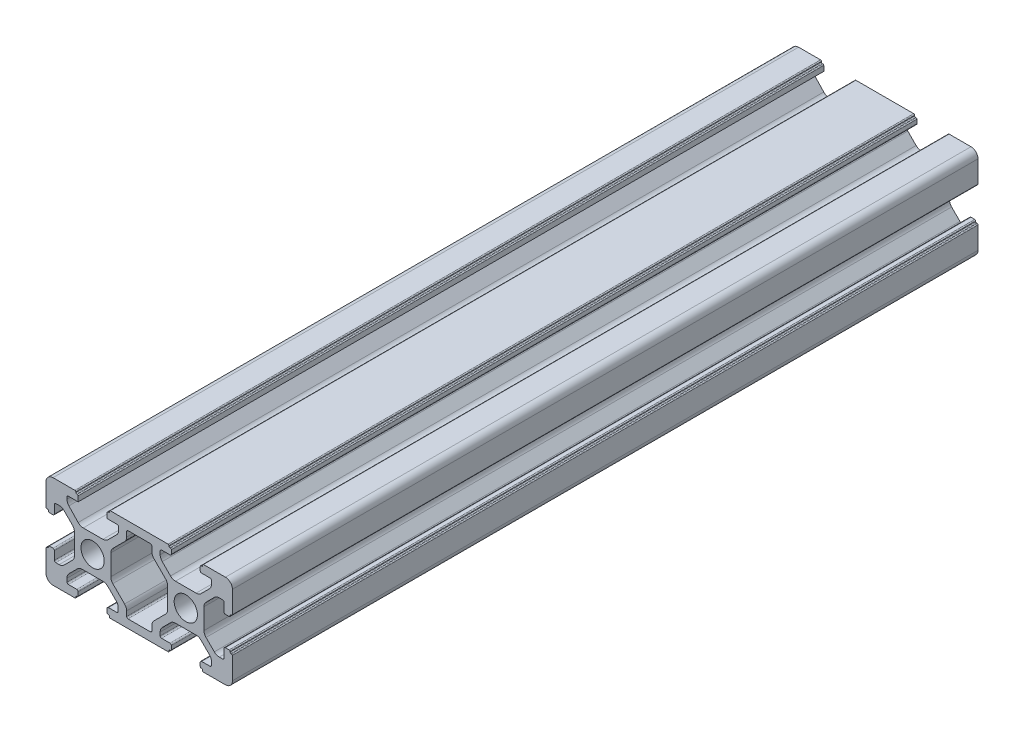
from build123d import *

# Parameters (mm, degrees)
SKETCH1_R           = 2.5
BOSS_EXTRUDE2_DEPTH = 160


with BuildPart() as part:
    # Sketch1 → Boss-Extrude2 (new body)
    with BuildSketch(Plane.XY):
        with BuildLine():
            Line((1.5, 0), (6.2, 0))
            ThreePointArc((6.2, 0), (6.341421356, 0.058578644), (6.4, 0.2))
            Line((6.4, 0.2), (6.4, 0.3))
            ThreePointArc((6.4, 0.3), (6.458578644, 0.441421356), (6.6, 0.5))
            Line((6.6, 0.5), (6.7, 0.5))
            ThreePointArc((6.7, 0.5), (6.841421356, 0.558578644), (6.9, 0.7))
            Line((6.9, 0.7), (6.9, 1.5))
            ThreePointArc((6.9, 1.5), (6.812132034, 1.712132034), (6.6, 1.8))
            Line((6.6, 1.8), (4.8, 1.8))
            ThreePointArc((4.8, 1.8), (4.587867966, 1.887867966), (4.5, 2.1))
            Line((4.5, 2.1), (4.5, 2.818019485))
            ThreePointArc((4.5, 2.818019485), (4.614180701, 3.392044633), (4.939339828, 3.878679656))
            Line((4.939339828, 3.878679656), (6.721320344, 5.660660172))
            ThreePointArc((6.721320344, 5.660660172), (7.207955367, 5.985819299), (7.781980515, 6.1))
            Line((7.781980515, 6.1), (12.218019485, 6.1))
            ThreePointArc((12.218019485, 6.1), (12.792044633, 5.985819299), (13.278679656, 5.660660172))
            Line((13.278679656, 5.660660172), (15.060660172, 3.878679656))
            ThreePointArc((15.060660172, 3.878679656), (15.385819299, 3.392044633), (15.5, 2.818019485))
            Line((15.5, 2.818019485), (15.5, 2.1))
            ThreePointArc((15.5, 2.1), (15.412132034, 1.887867966), (15.2, 1.8))
            Line((15.2, 1.8), (13.4, 1.8))
            ThreePointArc((13.4, 1.8), (13.187867966, 1.712132034), (13.1, 1.5))
            Line((13.1, 1.5), (13.1, 0.7))
            ThreePointArc((13.1, 0.7), (13.158578644, 0.558578644), (13.3, 0.5))
            Line((13.3, 0.5), (13.4, 0.5))
            ThreePointArc((13.4, 0.5), (13.541421356, 0.441421356), (13.6, 0.3))
            Line((13.6, 0.3), (13.6, 0.2))
            ThreePointArc((13.6, 0.2), (13.658578644, 0.058578644), (13.8, 0))
            Line((13.8, 0), (26.2, 0))
            ThreePointArc((26.2, 0), (26.341421356, 0.058578644), (26.4, 0.2))
            Line((26.4, 0.2), (26.4, 0.3))
            ThreePointArc((26.4, 0.3), (26.458578644, 0.441421356), (26.6, 0.5))
            Line((26.6, 0.5), (26.7, 0.5))
            ThreePointArc((26.7, 0.5), (26.841421356, 0.558578644), (26.9, 0.7))
            Line((26.9, 0.7), (26.9, 1.5))
            ThreePointArc((26.9, 1.5), (26.812132034, 1.712132034), (26.6, 1.8))
            Line((26.6, 1.8), (24.8, 1.8))
            ThreePointArc((24.8, 1.8), (24.587867966, 1.887867966), (24.5, 2.1))
            Line((24.5, 2.1), (24.5, 2.818019485))
            ThreePointArc((24.5, 2.818019485), (24.614180701, 3.392044633), (24.939339828, 3.878679656))
            Line((24.939339828, 3.878679656), (26.721320344, 5.660660172))
            ThreePointArc((26.721320344, 5.660660172), (27.207955367, 5.985819299), (27.781980515, 6.1))
            Line((27.781980515, 6.1), (32.218019485, 6.1))
            ThreePointArc((32.218019485, 6.1), (32.792044633, 5.985819299), (33.278679656, 5.660660172))
            Line((33.278679656, 5.660660172), (35.060660172, 3.878679656))
            ThreePointArc((35.060660172, 3.878679656), (35.385819299, 3.392044633), (35.5, 2.818019485))
            Line((35.5, 2.818019485), (35.5, 2.1))
            ThreePointArc((35.5, 2.1), (35.412132034, 1.887867966), (35.2, 1.8))
            Line((35.2, 1.8), (33.4, 1.8))
            ThreePointArc((33.4, 1.8), (33.187867966, 1.712132034), (33.1, 1.5))
            Line((33.1, 1.5), (33.1, 0.7))
            ThreePointArc((33.1, 0.7), (33.158578644, 0.558578644), (33.3, 0.5))
            Line((33.3, 0.5), (33.4, 0.5))
            ThreePointArc((33.4, 0.5), (33.541421356, 0.441421356), (33.6, 0.3))
            Line((33.6, 0.3), (33.6, 0.2))
            ThreePointArc((33.6, 0.2), (33.658578644, 0.058578644), (33.8, 0))
            Line((33.8, 0), (38.5, 0))
            ThreePointArc((38.5, 0), (39.560660172, 0.439339828), (40, 1.5))
            Line((40, 1.5), (40, 6.2))
            ThreePointArc((40, 6.2), (39.941421356, 6.341421356), (39.8, 6.4))
            Line((39.8, 6.4), (39.7, 6.4))
            ThreePointArc((39.7, 6.4), (39.558578644, 6.458578644), (39.5, 6.6))
            Line((39.5, 6.6), (39.5, 6.7))
            ThreePointArc((39.5, 6.7), (39.441421356, 6.841421356), (39.3, 6.9))
            Line((39.3, 6.9), (38.5, 6.9))
            ThreePointArc((38.5, 6.9), (38.287867966, 6.812132034), (38.2, 6.6))
            Line((38.2, 6.6), (38.2, 4.8))
            ThreePointArc((38.2, 4.8), (38.112132034, 4.587867966), (37.9, 4.5))
            Line((37.9, 4.5), (37.181980515, 4.5))
            ThreePointArc((37.181980515, 4.5), (36.607955367, 4.614180701), (36.121320344, 4.939339828))
            Line((36.121320344, 4.939339828), (34.339339828, 6.721320344))
            ThreePointArc((34.339339828, 6.721320344), (34.014180701, 7.207955367), (33.9, 7.781980515))
            Line((33.9, 7.781980515), (33.9, 12.218019485))
            ThreePointArc((33.9, 12.218019485), (34.014180701, 12.792044633), (34.339339828, 13.278679656))
            Line((34.339339828, 13.278679656), (36.121320344, 15.060660172))
            ThreePointArc((36.121320344, 15.060660172), (36.607955367, 15.385819299), (37.181980515, 15.5))
            Line((37.181980515, 15.5), (37.9, 15.5))
            ThreePointArc((37.9, 15.5), (38.112132034, 15.412132034), (38.2, 15.2))
            Line((38.2, 15.2), (38.2, 13.4))
            ThreePointArc((38.2, 13.4), (38.287867966, 13.187867966), (38.5, 13.1))
            Line((38.5, 13.1), (39.3, 13.1))
            ThreePointArc((39.3, 13.1), (39.441421356, 13.158578644), (39.5, 13.3))
            Line((39.5, 13.3), (39.5, 13.4))
            ThreePointArc((39.5, 13.4), (39.558578644, 13.541421356), (39.7, 13.6))
            Line((39.7, 13.6), (39.8, 13.6))
            ThreePointArc((39.8, 13.6), (39.941421356, 13.658578644), (40, 13.8))
            Line((40, 13.8), (40, 18.5))
            ThreePointArc((40, 18.5), (39.560660172, 19.560660172), (38.5, 20))
            Line((38.5, 20), (33.8, 20))
            ThreePointArc((33.8, 20), (33.658578644, 19.941421356), (33.6, 19.8))
            Line((33.6, 19.8), (33.6, 19.7))
            ThreePointArc((33.6, 19.7), (33.541421356, 19.558578644), (33.4, 19.5))
            Line((33.4, 19.5), (33.3, 19.5))
            ThreePointArc((33.3, 19.5), (33.158578644, 19.441421356), (33.1, 19.3))
            Line((33.1, 19.3), (33.1, 18.5))
            ThreePointArc((33.1, 18.5), (33.187867966, 18.287867966), (33.4, 18.2))
            Line((33.4, 18.2), (35.2, 18.2))
            ThreePointArc((35.2, 18.2), (35.412132034, 18.112132034), (35.5, 17.9))
            Line((35.5, 17.9), (35.5, 17.181980515))
            ThreePointArc((35.5, 17.181980515), (35.385819299, 16.607955367), (35.060660172, 16.121320344))
            Line((35.060660172, 16.121320344), (33.278679656, 14.339339828))
            ThreePointArc((33.278679656, 14.339339828), (32.792044633, 14.014180701), (32.218019485, 13.9))
            Line((32.218019485, 13.9), (27.781980515, 13.9))
            ThreePointArc((27.781980515, 13.9), (27.207955367, 14.014180701), (26.721320344, 14.339339828))
            Line((26.721320344, 14.339339828), (24.939339828, 16.121320344))
            ThreePointArc((24.939339828, 16.121320344), (24.614180701, 16.607955367), (24.5, 17.181980515))
            Line((24.5, 17.181980515), (24.5, 17.9))
            ThreePointArc((24.5, 17.9), (24.587867966, 18.112132034), (24.8, 18.2))
            Line((24.8, 18.2), (26.6, 18.2))
            ThreePointArc((26.6, 18.2), (26.812132034, 18.287867966), (26.9, 18.5))
            Line((26.9, 18.5), (26.9, 19.3))
            ThreePointArc((26.9, 19.3), (26.841421356, 19.441421356), (26.7, 19.5))
            Line((26.7, 19.5), (26.6, 19.5))
            ThreePointArc((26.6, 19.5), (26.458578644, 19.558578644), (26.4, 19.7))
            Line((26.4, 19.7), (26.4, 19.8))
            ThreePointArc((26.4, 19.8), (26.341421356, 19.941421356), (26.2, 20))
            Line((26.2, 20), (13.8, 20))
            ThreePointArc((13.8, 20), (13.658578644, 19.941421356), (13.6, 19.8))
            Line((13.6, 19.8), (13.6, 19.7))
            ThreePointArc((13.6, 19.7), (13.541421356, 19.558578644), (13.4, 19.5))
            Line((13.4, 19.5), (13.3, 19.5))
            ThreePointArc((13.3, 19.5), (13.158578644, 19.441421356), (13.1, 19.3))
            Line((13.1, 19.3), (13.1, 18.2))
            Line((13.1, 18.2), (15.3, 18.2))
            ThreePointArc((15.3, 18.2), (15.512132034, 18.112132034), (15.6, 17.9))
            Line((15.6, 17.9), (15.6, 17.281980515))
            ThreePointArc((15.6, 17.281980515), (15.485819299, 16.707955367), (15.160660172, 16.221320344))
            Line((15.160660172, 16.221320344), (13.278679656, 14.339339828))
            ThreePointArc((13.278679656, 14.339339828), (12.792044633, 14.014180701), (12.218019485, 13.9))
            Line((12.218019485, 13.9), (7.986375635, 13.9))
            ThreePointArc((7.986375635, 13.9), (7.393381044, 14.022191082), (6.896997987, 14.36885678))
            Line((6.896997987, 14.36885678), (4.910622352, 16.467414163))
            ThreePointArc((4.910622352, 16.467414163), (4.606431474, 16.943609851), (4.5, 17.498557383))
            Line((4.5, 17.498557383), (4.5, 17.9))
            ThreePointArc((4.5, 17.9), (4.587867966, 18.112132034), (4.8, 18.2))
            Line((4.8, 18.2), (6.9, 18.2))
            Line((6.9, 18.2), (6.9, 19.3))
            ThreePointArc((6.9, 19.3), (6.841421356, 19.441421356), (6.7, 19.5))
            Line((6.7, 19.5), (6.6, 19.5))
            ThreePointArc((6.6, 19.5), (6.458578644, 19.558578644), (6.4, 19.7))
            Line((6.4, 19.7), (6.4, 19.8))
            ThreePointArc((6.4, 19.8), (6.341421356, 19.941421356), (6.2, 20))
            Line((6.2, 20), (1.5, 20))
            ThreePointArc((1.5, 20), (0.439339828, 19.560660172), (0, 18.5))
            Line((0, 18.5), (0, 13.8))
            ThreePointArc((0, 13.8), (0.058578644, 13.658578644), (0.2, 13.6))
            Line((0.2, 13.6), (0.3, 13.6))
            ThreePointArc((0.3, 13.6), (0.441421356, 13.541421356), (0.5, 13.4))
            Line((0.5, 13.4), (0.5, 13.3))
            ThreePointArc((0.5, 13.3), (0.558578644, 13.158578644), (0.7, 13.1))
            Line((0.7, 13.1), (1.5, 13.1))
            ThreePointArc((1.5, 13.1), (1.712132034, 13.187867966), (1.8, 13.4))
            Line((1.8, 13.4), (1.8, 15.2))
            ThreePointArc((1.8, 15.2), (1.887867966, 15.412132034), (2.1, 15.5))
            Line((2.1, 15.5), (2.818019485, 15.5))
            ThreePointArc((2.818019485, 15.5), (3.392044633, 15.385819299), (3.878679656, 15.060660172))
            Line((3.878679656, 15.060660172), (5.660660172, 13.278679656))
            ThreePointArc((5.660660172, 13.278679656), (5.985819299, 12.792044633), (6.1, 12.218019485))
            Line((6.1, 12.218019485), (6.1, 7.781980515))
            ThreePointArc((6.1, 7.781980515), (5.985819299, 7.207955367), (5.660660172, 6.721320344))
            Line((5.660660172, 6.721320344), (3.878679656, 4.939339828))
            ThreePointArc((3.878679656, 4.939339828), (3.392044633, 4.614180701), (2.818019485, 4.5))
            Line((2.818019485, 4.5), (2.1, 4.5))
            ThreePointArc((2.1, 4.5), (1.887867966, 4.587867966), (1.8, 4.8))
            Line((1.8, 4.8), (1.8, 6.6))
            ThreePointArc((1.8, 6.6), (1.712132034, 6.812132034), (1.5, 6.9))
            Line((1.5, 6.9), (0.7, 6.9))
            ThreePointArc((0.7, 6.9), (0.558578644, 6.841421356), (0.5, 6.7))
            Line((0.5, 6.7), (0.5, 6.6))
            ThreePointArc((0.5, 6.6), (0.441421356, 6.458578644), (0.3, 6.4))
            Line((0.3, 6.4), (0.2, 6.4))
            ThreePointArc((0.2, 6.4), (0.058578644, 6.341421356), (0, 6.2))
            Line((0, 6.2), (0, 1.5))
            ThreePointArc((0, 1.5), (0.439339828, 0.439339828), (1.5, 0))
        make_face()
        with Locations((10, 10)):
            Circle(SKETCH1_R, mode=Mode.SUBTRACT)
        with Locations((30, 10)):
            Circle(SKETCH1_R, mode=Mode.SUBTRACT)
        with BuildLine():
            Line((17.6, 1.8), (22.4, 1.8))
            ThreePointArc((22.4, 1.8), (22.612132034, 1.887867966), (22.7, 2.1))
            Line((22.7, 2.1), (22.7, 3.139339828))
            ThreePointArc((22.7, 3.139339828), (22.814180701, 3.713364977), (23.139339828, 4.2))
            Line((23.139339828, 4.2), (25.660660172, 6.721320344))
            ThreePointArc((25.660660172, 6.721320344), (25.985819299, 7.207955367), (26.1, 7.781980515))
            Line((26.1, 7.781980515), (26.1, 12.218019485))
            ThreePointArc((26.1, 12.218019485), (25.985819299, 12.792044633), (25.660660172, 13.278679656))
            Line((25.660660172, 13.278679656), (23.139339828, 15.8))
            ThreePointArc((23.139339828, 15.8), (22.814180701, 16.286635023), (22.7, 16.860660172))
            Line((22.7, 16.860660172), (22.7, 17.9))
            ThreePointArc((22.7, 17.9), (22.612132034, 18.112132034), (22.4, 18.2))
            Line((22.4, 18.2), (17.6, 18.2))
            ThreePointArc((17.6, 18.2), (17.387867966, 18.112132034), (17.3, 17.9))
            Line((17.3, 17.9), (17.3, 16.860660172))
            ThreePointArc((17.3, 16.860660172), (17.185819299, 16.286635023), (16.860660172, 15.8))
            Line((16.860660172, 15.8), (14.339339828, 13.278679656))
            ThreePointArc((14.339339828, 13.278679656), (14.014180701, 12.792044633), (13.9, 12.218019485))
            Line((13.9, 12.218019485), (13.9, 7.781980515))
            ThreePointArc((13.9, 7.781980515), (14.014180701, 7.207955367), (14.339339828, 6.721320344))
            Line((14.339339828, 6.721320344), (16.860660172, 4.2))
            ThreePointArc((16.860660172, 4.2), (17.185819299, 3.713364977), (17.3, 3.139339828))
            Line((17.3, 3.139339828), (17.3, 2.1))
            ThreePointArc((17.3, 2.1), (17.387867966, 1.887867966), (17.6, 1.8))
        make_face(mode=Mode.SUBTRACT)
    extrude(amount=BOSS_EXTRUDE2_DEPTH)


solid = part.part
